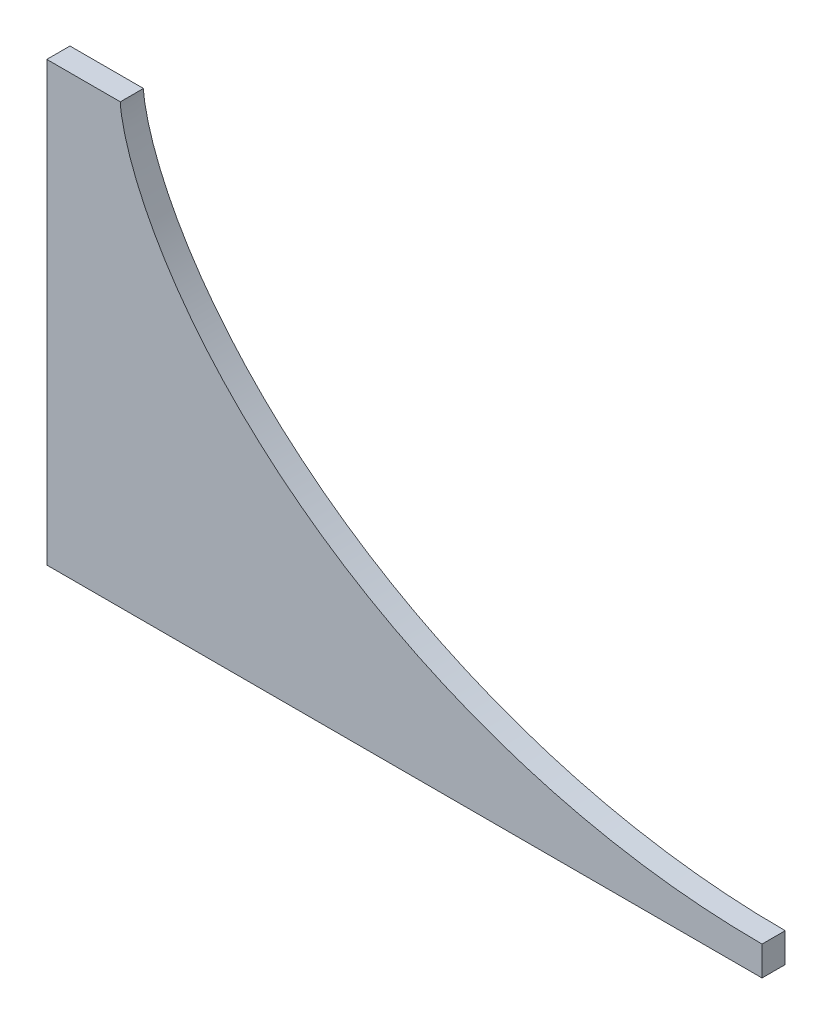
from build123d import *

# Parameters (mm, degrees)
BOSS_EXTRUDE1_DEPTH = 2.5


with BuildPart() as part:
    # Sketch1 → Boss-Extrude1 (new, symmetric)
    with BuildSketch(Plane.XY):
        with BuildLine():
            Line((-138.606439558, 88.2396), (-154.481439558, 88.2396))
            Line((-154.481439558, 88.2396), (-154.481439558, -6.35))
            Line((-154.481439558, -6.35), (0, -6.35))
            Line((0, -6.35), (0, 0))
            add(Edge.make_bspline(
                [(-138.606439558, 88.2396), (-138.606439558, 88.206480064), (-138.604893224, 88.134332137), (-138.597757085, 87.982040168), (-138.584504009, 87.767973581), (-138.563362589, 87.511833211), (-138.514302662, 87.023426652), (-138.425196169, 86.336581908), (-138.262733573, 85.340165391), (-137.997774346, 84.039042844), (-137.543893872, 82.163940465), (-136.709143666, 79.332808223), (-135.381511976, 75.692405853), (-133.427089014, 71.311625777), (-130.978665346, 66.686011286), (-128.248792738, 62.200876138), (-125.278396767, 57.871801388), (-121.922980854, 53.47598485), (-117.499907722, 48.25477976), (-111.846477366, 42.372548658), (-104.806706424, 36.032698765), (-96.481239759, 29.625824358), (-87.711829988, 23.843138375), (-78.562226684, 18.684637722), (-69.088219119, 14.150320925), (-59.340712588, 10.240190432), (-49.365347684, 6.954244107), (-41.111501611, 4.791563651), (-34.694119901, 3.420549472), (-30.177735786, 2.597379945), (-27.586849558, 2.166008761), (-24.349433278, 1.675559443), (-20.435573897, 1.165043535), (-15.888225625, 0.68322541), (-11.278370624, 0.337947753), (-7.392012303, 0.139524343), (-4.35262006, 0.048647043), (-2.477110072, 0.012428268), (-0.93320285, 0.001817838), (-0.315317676, 0), (0, 0)],
                knots=[0, 0, 0, 0, 0, 0.000750682, 0.001501364, 0.003002728, 0.004504092, 0.006005456, 0.011632897, 0.017260339, 0.025307868, 0.033355398, 0.051377592, 0.078047856, 0.105080676, 0.132113154, 0.15914583, 0.186178382, 0.213211084, 0.24601624, 0.3000815, 0.354146872, 0.408211991, 0.462277325, 0.516342503, 0.570407831, 0.624473028, 0.67853828, 0.732603517, 0.746119838, 0.759636158, 0.773152478, 0.786668798, 0.813701417, 0.840734035, 0.867766658, 0.88128297, 0.894799281, 0.901946134, 0.909092986, 0.909092986, 0.909092986, 0.909092986, 0.909092986], degree=4))
        make_face()
    extrude(amount=BOSS_EXTRUDE1_DEPTH, both=True)


solid = part.part
